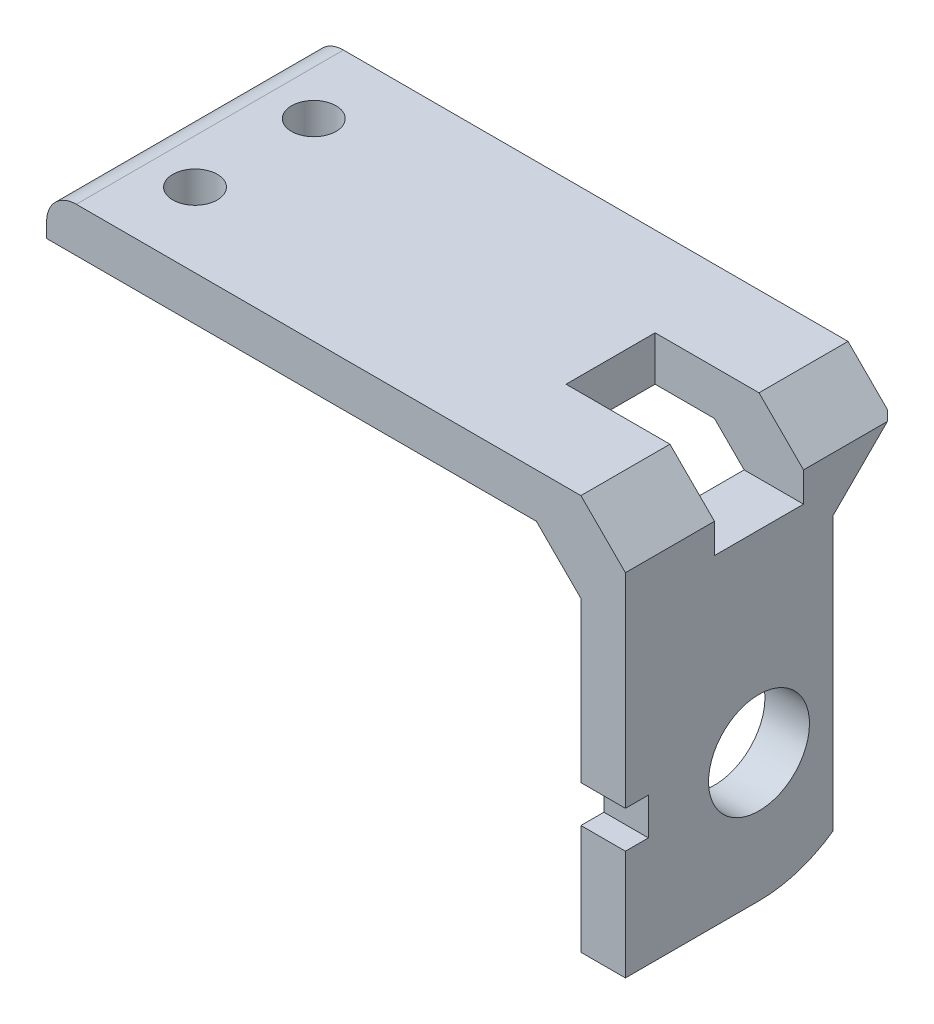
from build123d import *

# Parameters (mm, degrees)
SALIENTE_EXTRUIR1_DEPTH = 18
CROQUIS2_R              = 3.4
CORTAR_EXTRUIR1_DEPTH   = 22
CROQUIS3_R              = 1.5
CORTAR_EXTRUIR2_DEPTH   = 22
CROQUIS4_W              = 1.55
CROQUIS4_H              = 2.5
CORTAR_EXTRUIR3_DEPTH   = 47.683139164
CHAFL_N1_SIZE           = 3
CROQUIS5_W              = 10
CROQUIS5_H              = 6
CORTAR_EXTRUIR4_DEPTH   = 5


with BuildPart() as part:
    # Croquis1 → Saliente-Extruir1 (new body)
    with BuildSketch(Plane.XY):
        with BuildLine():
            Line((0, -6.350148368), (0, 20.649851632))
            Line((0, 20.649851632), (-36, 20.649851632))
            Line((-36, 20.649851632), (-36, 21.649851632))
            ThreePointArc((-36, 21.649851632), (-35.414213562, 23.064065194), (-34, 23.649851632))
            Line((-34, 23.649851632), (3, 23.649851632))
            Line((3, 23.649851632), (3, -6.350148368))
            Line((3, -6.350148368), (0, -6.350148368))
        make_face()
    extrude(amount=SALIENTE_EXTRUIR1_DEPTH)

    # Croquis2 → Cortar-Extruir1 (cut)
    with BuildSketch(Plane(origin=(3, 0, 0), x_dir=(0, 0, -1), z_dir=(1, 0, 0))):
        with Locations(Location((-9, 5.649851632, 0), (0, 0, 90))):
            Circle(CROQUIS2_R)
    extrude(amount=-CORTAR_EXTRUIR1_DEPTH, mode=Mode.SUBTRACT)

    # Croquis3 → Cortar-Extruir2 (cut)
    with BuildSketch(Plane(origin=(0, 23.649851632, 0), x_dir=(1, 0, 0), z_dir=(0, 1, 0))):
        with Locations(Location((-31, -5, 0), (0, 0, 180))):
            Circle(CROQUIS3_R)
        with Locations(Location((-31, -13, 0), (0, 0, 180))):
            Circle(CROQUIS3_R)
    extrude(amount=-CORTAR_EXTRUIR2_DEPTH, mode=Mode.SUBTRACT)

    # Croquis4 → Cortar-Extruir3 (cut, through all)
    with BuildSketch(Plane.ZY):
        with BuildLine():
            Line((0, 20.999851632), (4, 16.999851632))
            Line((4, 16.999851632), (4, -1.408653875))
            ThreePointArc((4, -1.408653875), (6.37641206, -2.59267749), (9, -3.000148368))
            Line((9, -3.000148368), (18, -3.000148368))
            Line((18, -3.000148368), (18, -6.350148368))
            Line((18, -6.350148368), (0, -6.350148368))
            Line((0, -6.350148368), (0, 20.999851632))
        make_face()
        with Locations((17.225, 5.649851632)):
            Rectangle(CROQUIS4_W, CROQUIS4_H)
    extrude(amount=-CORTAR_EXTRUIR3_DEPTH, mode=Mode.SUBTRACT)

    # Chaflán1
    chafl_n1_edges = [part.edges().sort_by_distance(p)[0] for p in [
        (3, 23.649851632, 9),
        (0, 20.649851632, 9.175),
    ]]
    chamfer(chafl_n1_edges, length=CHAFL_N1_SIZE)

    # Croquis5 → Cortar-Extruir4 (cut)
    with BuildSketch(Plane(origin=(0, 23.649851632, 0), x_dir=(1, 0, 0), z_dir=(0, 1, 0))):
        with Locations((-2, -9)):
            Rectangle(CROQUIS5_W, CROQUIS5_H)
    extrude(amount=-CORTAR_EXTRUIR4_DEPTH, mode=Mode.SUBTRACT)


solid = part.part
